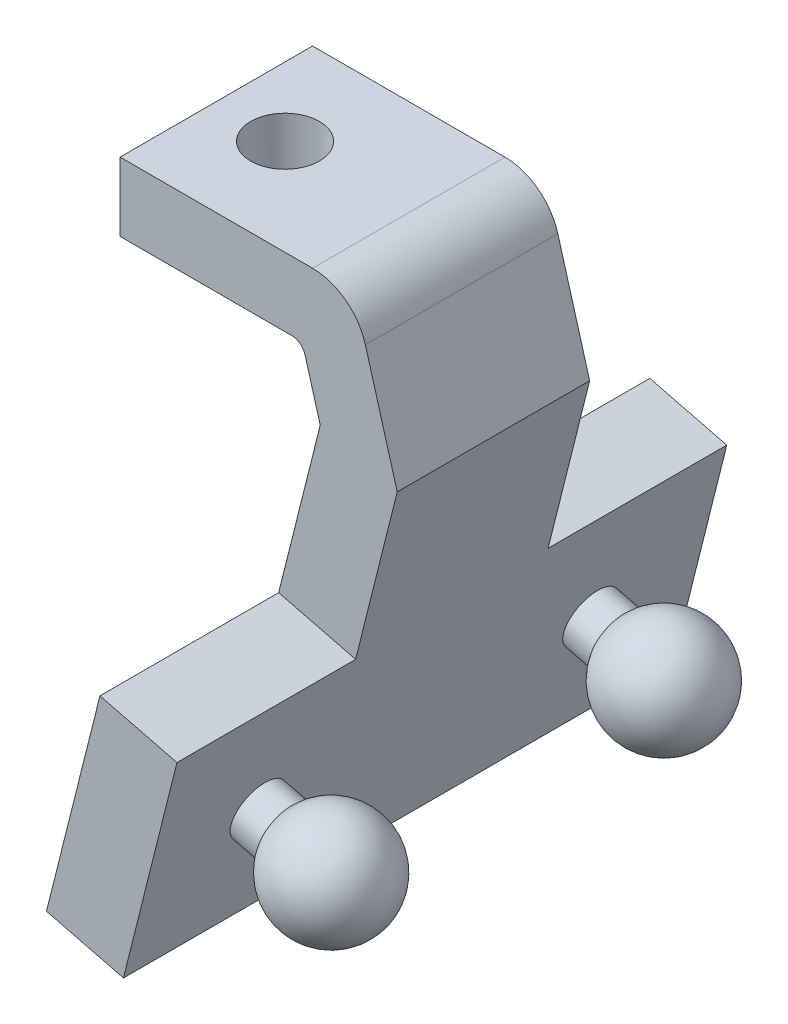
from build123d import *
from build123d.topology import SkipClean

# Parameters (mm, degrees)
EXTRUDE_1_DEPTH     = 3.5
SKETCH_2_R          = 1.25
CUT_EXTRUDE_3_DEPTH = 5.5
SKETCH_3_W          = 20
SKETCH_3_H          = 8
EXTRUDE_2_DEPTH     = 2.886751
SKETCH_4_R          = 1
EXTRUDE_3_DEPTH     = 1


with BuildPart() as part:
    # 草图1 → 凸台-拉伸1 (new, symmetric)
    with BuildSketch(Plane.XY):
        with BuildLine():
            Line((0, 0), (6.245432753, 0))
            ThreePointArc((6.245432753, 0), (6.54659813, -0.100876691), (6.72624124, -0.362802336))
            Line((6.72624124, -0.362802336), (7.280170813, -2.304045596))
            Line((7.280170813, -2.304045596), (3.822659371, -16.095442623))
            Line((3.822659371, -16.095442623), (6.622757346, -16.797428852))
            Line((6.622757346, -16.797428852), (10.080268787, -3.006031824))
            Line((10.080268787, -3.006031824), (8.923233948, 1.048790655))
            ThreePointArc((8.923233948, 1.048790655), (8.204661507, 2.096493237), (7, 2.5))
            Line((7, 2.5), (0, 2.5))
            Line((0, 2.5), (0, 0))
        make_face()
    extrude(amount=EXTRUDE_1_DEPTH, both=True)

    # 草图2 → 切除-拉伸3 (cut)
    with BuildSketch(Plane.XZ):
        with Locations((2.5, 0)):
            Circle(SKETCH_2_R)
    extrude(amount=-CUT_EXTRUDE_3_DEPTH, mode=Mode.SUBTRACT)

    # 草图3 → 凸台-拉伸2 (add)
    with SkipClean():  # the faces are left unmerged after this step: merging them gives an invalid solid
        with BuildSketch(Plane(origin=(10.193230201, -2.555448877, 0), x_dir=(0, 0, -1), z_dir=(0.969982391695105, -0.24317516279719864, 0))):
            with Locations((0, -10.682720116)):
                Rectangle(SKETCH_3_W, SKETCH_3_H)
        extrude(amount=-EXTRUDE_2_DEPTH)

    # 草图4 → 凸台-拉伸3 (add)
    with SkipClean():  # the faces are left unmerged after this step: merging them gives an invalid solid
        with BuildSketch(Plane(origin=(10.193230201, -2.555448877, 0), x_dir=(0, 0, -1), z_dir=(0.969982391695105, -0.24317516279719864, 0))):
            with Locations(Location((-6.050193859, -10.752531826, 0), (0, 0, 270))):
                Circle(SKETCH_4_R)
        extrude_3 = extrude(amount=EXTRUDE_3_DEPTH)

    # 草图5 → 旋转1 (revolve)
    with SkipClean():  # the faces are left unmerged after this step: merging them gives an invalid solid
        with BuildSketch(Plane(origin=(-2.614748677, -10.429766537, 0), x_dir=(-0.969982391695105, 0.24317516279719864, 0), z_dir=(0.24317516279719864, 0.969982391695105, 0))):
            with BuildLine():
                Line((-11.508675506, 6.050193859), (-15.240726313, 6.050193859))
                ThreePointArc((-15.240726313, 6.050193859), (-13.758364403, 7.982045511), (-11.508675506, 7.050193859))
                Line((-11.508675506, 7.050193859), (-11.508675506, 6.050193859))
            make_face()
        revolve_1 = revolve(axis=Axis((8.548463915, -13.228390577, 6.050193859), (0.9699823916951049, -0.24317516279719897, 0)))

    # 镜向1: 凸台-拉伸3, 旋转1 across plane
    with SkipClean():  # the faces are left unmerged after this step: merging them gives an invalid solid
        add(extrude_3.mirror(Plane.XY))
        add(revolve_1.mirror(Plane.XY))


solid = part.part
